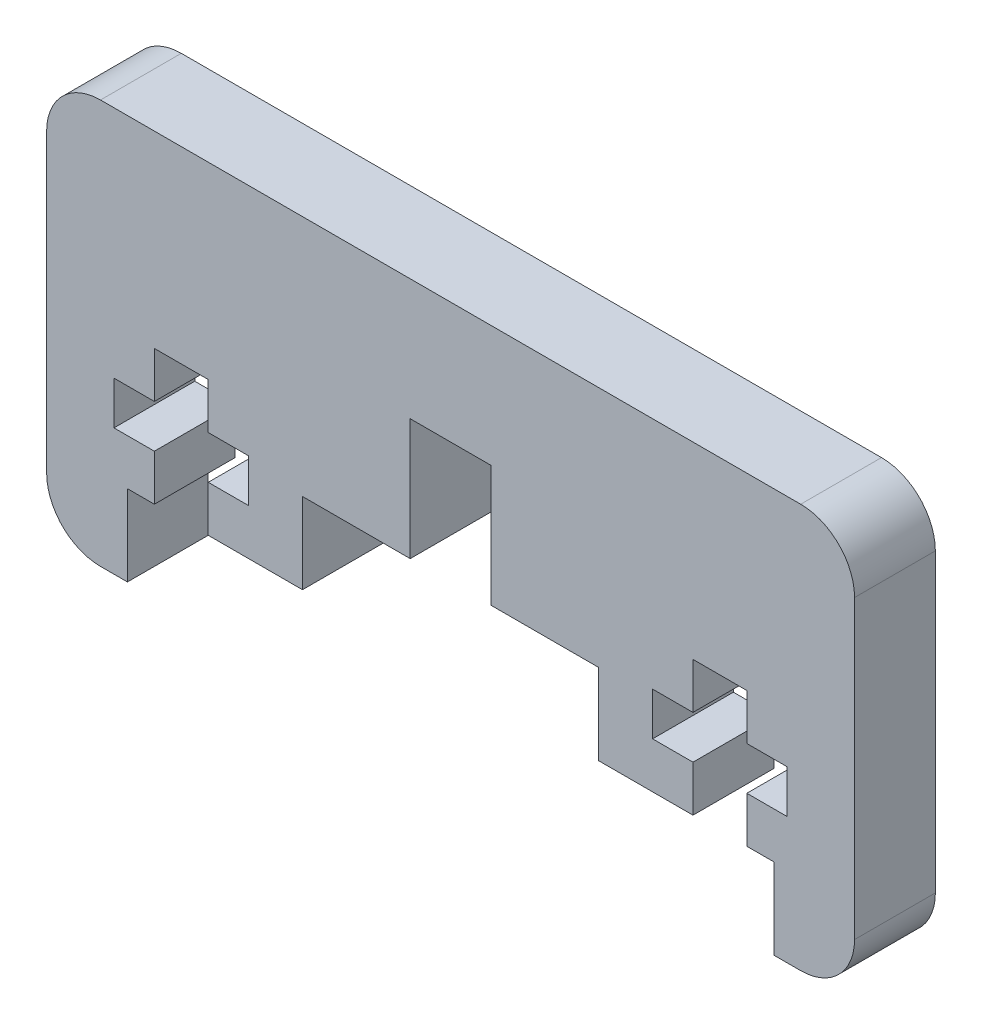
from build123d import *

# Parameters (mm, degrees)
BOSS_EXTRU_1_DEPTH = 15


with BuildPart() as part:
    # Esquisse1 → Boss.-Extru.1 (new body)
    with BuildSketch(Plane.XY):
        with BuildLine():
            Line((65, 37.5), (-65, 37.5))
            ThreePointArc((-65, 37.5), (-72.071067812, 34.571067812), (-75, 27.5))
            Line((-75, 27.5), (-75, -27.5))
            ThreePointArc((-75, -27.5), (-72.071067812, -34.571067812), (-65, -37.5))
            Line((-65, -37.5), (-60, -37.5))
            Line((-60, -37.5), (-60, -22.5))
            Line((-60, -22.5), (-55, -22.5))
            Line((-55, -22.5), (-55, -13.973661668))
            Line((-55, -13.973661668), (-62.5, -13.973661668))
            Line((-62.5, -13.973661668), (-62.5, -5.973661668))
            Line((-62.5, -5.973661668), (-55, -5.973661668))
            Line((-55, -5.973661668), (-55, 2.552676663))
            Line((-55, 2.552676663), (-45, 2.552676663))
            Line((-45, 2.552676663), (-45, -5.973661668))
            Line((-45, -5.973661668), (-37.5, -5.973661668))
            Line((-37.5, -5.973661668), (-37.5, -13.973661668))
            Line((-37.5, -13.973661668), (-45, -13.973661668))
            Line((-45, -13.973661668), (-45, -22.5))
            Line((-45, -22.5), (-27.5, -22.5))
            Line((-27.5, -22.5), (-27.5, -7.5))
            Line((-27.5, -7.5), (-7.5, -7.5))
            Line((-7.5, -7.5), (-7.5, 15))
            Line((-7.5, 15), (7.5, 15))
            Line((7.5, 15), (7.5, -7.5))
            Line((7.5, -7.5), (27.5, -7.5))
            Line((27.5, -7.5), (27.5, -22.5))
            Line((27.5, -22.5), (45, -22.5))
            Line((45, -22.5), (45, -13.973661668))
            Line((45, -13.973661668), (37.5, -13.973661668))
            Line((37.5, -13.973661668), (37.5, -5.973661668))
            Line((37.5, -5.973661668), (45, -5.973661668))
            Line((45, -5.973661668), (45, 2.552676663))
            Line((45, 2.552676663), (55, 2.552676663))
            Line((55, 2.552676663), (55, -5.973661668))
            Line((55, -5.973661668), (62.5, -5.973661668))
            Line((62.5, -5.973661668), (62.5, -13.973661668))
            Line((62.5, -13.973661668), (55, -13.973661668))
            Line((55, -13.973661668), (55, -22.5))
            Line((55, -22.5), (60, -22.5))
            Line((60, -22.5), (60, -37.5))
            Line((60, -37.5), (65, -37.5))
            ThreePointArc((65, -37.5), (72.071067812, -34.571067812), (75, -27.5))
            Line((75, -27.5), (75, 27.5))
            ThreePointArc((75, 27.5), (72.071067812, 34.571067812), (65, 37.5))
        make_face()
    extrude(amount=BOSS_EXTRU_1_DEPTH)


solid = part.part
